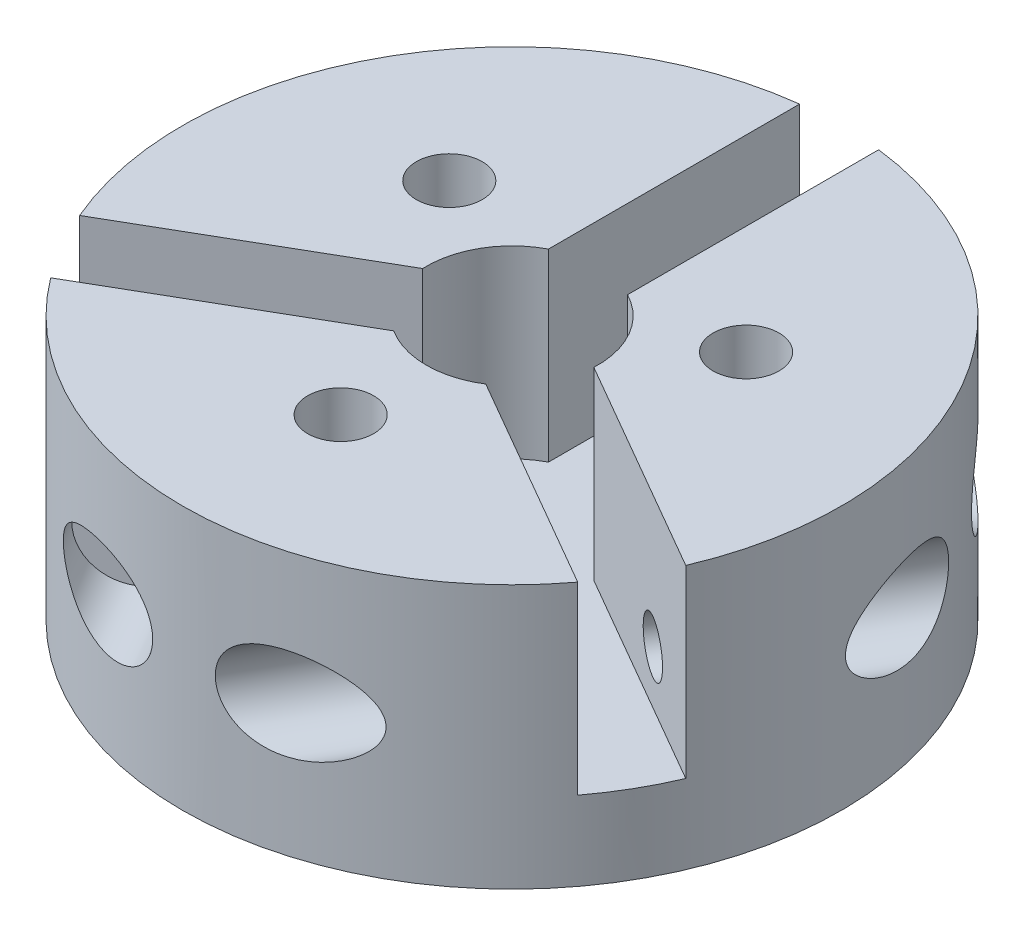
from build123d import *

# Parameters (mm, degrees)
SKETCH1_R                   = 125
BOSS_EXTRUDE1_DEPTH         = 50
SKETCH2_R                   = 12.5
CUT_EXTRUDE1_DEPTH          = 100
CUT_EXTRUDE2_DEPTH          = 70
SKETCH4_R                   = 10
CUT_EXTRUDE3_DEPTH          = 184.711730709
SKETCH6_R                   = 17.5
CUT_EXTRUDE5_DEPTH          = 55
CIRPATTERN2_COUNT           = 3
CIRPATTERN3_COPY_1_SKETCH_R = 17.5
CIRPATTERN3_COPY_1_DEPTH    = 55
CIRPATTERN3_COPY_2_SKETCH_R = 17.5
CIRPATTERN3_COPY_2_DEPTH    = 55
CIRPATTERN3_COPY_3_SKETCH_R = 17.5
CIRPATTERN3_COPY_3_DEPTH    = 55
CIRPATTERN3_COPY_4_SKETCH_R = 17.5
CIRPATTERN3_COPY_4_DEPTH    = 55
CIRPATTERN4_COUNT           = 3


with BuildPart() as part:
    # Sketch1 → Boss-Extrude1 (new, symmetric)
    with BuildSketch(Plane(origin=(0, 0, 0), x_dir=(1, 0, 0), z_dir=(0, 1, 0))):
        with Locations(Location((0, 0, 0), (0, 0, 270))):
            Circle(SKETCH1_R)
    extrude(amount=BOSS_EXTRUDE1_DEPTH, both=True)

    # Sketch2 → Cut-Extrude1 (cut)
    with BuildSketch(Plane(origin=(0, 50, 0), x_dir=(1, 0, 0), z_dir=(0, 1, 0))):
        with Locations(Location((0, -65, 0), (0, 0, 270))):
            Circle(SKETCH2_R)
        with Locations(Location((-56.291651246, 32.5, 0), (0, 0, 270))):
            Circle(SKETCH2_R)
        with Locations(Location((56.291651246, 32.5, 0), (0, 0, 270))):
            Circle(SKETCH2_R)
    extrude(amount=-CUT_EXTRUDE1_DEPTH, mode=Mode.SUBTRACT)

    # Sketch3 → Cut-Extrude2 (cut)
    with BuildSketch(Plane(origin=(0, 50, 0), x_dir=(1, 0, 0), z_dir=(0, 1, 0))):
        with BuildLine():
            Line((-15, 124.09673646), (-15, 28.831406487))
            ThreePointArc((-15, 28.831406487), (-28.145825623, 16.25), (-32.468730444, -1.425322187))
            Line((-32.468730444, -1.425322187), (-114.970926301, -49.057987173))
            ThreePointArc((-114.970926301, -49.057987173), (-108.253175473, -62.5), (-99.970926301, -75.038749287))
            Line((-99.970926301, -75.038749287), (-17.468730444, -27.4060843))
            ThreePointArc((-17.468730444, -27.4060843), (0, -32.5), (17.468730444, -27.4060843))
            Line((17.468730444, -27.4060843), (99.970926301, -75.038749287))
            ThreePointArc((99.970926301, -75.038749287), (108.253175473, -62.5), (114.970926301, -49.057987173))
            Line((114.970926301, -49.057987173), (32.468730444, -1.425322187))
            ThreePointArc((32.468730444, -1.425322187), (28.145825623, 16.25), (15, 28.831406487))
            Line((15, 28.831406487), (15, 124.09673646))
            ThreePointArc((15, 124.09673646), (0, 125), (-15, 124.09673646))
        make_face()
    extrude(amount=-CUT_EXTRUDE2_DEPTH, mode=Mode.SUBTRACT)

    # Sketch4 → Cut-Extrude3 (cut, symmetric)
    with BuildSketch(Plane(origin=(0, 0, 0), x_dir=(0, 0, -1), z_dir=(1, 0, 0))):
        with Locations((90, 0)):
            Circle(SKETCH4_R)
    cut_extrude3 = extrude(amount=CUT_EXTRUDE3_DEPTH, both=True, mode=Mode.SUBTRACT)

    # Sketch6 → Cut-Extrude5 (cut)
    with BuildSketch(Plane(origin=(55, 0, 0), x_dir=(0, 0, -1), z_dir=(1, 0, 0))):
        with Locations(Location((90, 0, 0), (0, 0, 180))):
            Circle(SKETCH6_R)
    cut_extrude5 = extrude(amount=CUT_EXTRUDE5_DEPTH, mode=Mode.SUBTRACT)

    # Mirror1: Cut-Extrude5 across plane
    add(cut_extrude5.mirror(Plane(origin=(0, 0, 0), x_dir=(0, 0, 1), z_dir=(1, 0, 0))), mode=Mode.SUBTRACT)

    # CirPattern2: Cut-Extrude5 ×3 about axis
    cirpattern2_axis = Axis((0, 0, 0), (0, 1, 0))
    for i in range(1, CIRPATTERN2_COUNT):
        add(cut_extrude5.rotate(cirpattern2_axis, i * 360 / CIRPATTERN2_COUNT), mode=Mode.SUBTRACT)

    # CirPattern3 copy 1 sketch → CirPattern3 copy 1 (cut)
    with BuildSketch(Plane(origin=(27.5, 0, 47.631397208), x_dir=(-0.8660254037844387, 0, 0.4999999999999998), z_dir=(0.4999999999999998, 0, 0.8660254037844387))):
        with Locations((90, 0)):
            Circle(CIRPATTERN3_COPY_1_SKETCH_R)
    extrude(amount=CIRPATTERN3_COPY_1_DEPTH, mode=Mode.SUBTRACT)

    # CirPattern3 copy 2 sketch → CirPattern3 copy 2 (cut)
    with BuildSketch(Plane(origin=(27.5, 0, -47.631397208), x_dir=(0.8660254037844384, 0, 0.5000000000000004), z_dir=(0.5000000000000004, 0, -0.8660254037844384))):
        with Locations((90, 0)):
            Circle(CIRPATTERN3_COPY_2_SKETCH_R)
    extrude(amount=CIRPATTERN3_COPY_2_DEPTH, mode=Mode.SUBTRACT)

    # CirPattern3 copy 3 sketch → CirPattern3 copy 3 (cut)
    with BuildSketch(Plane(origin=(-27.5, 0, -47.631397208), x_dir=(-0.8660254037844387, 0, 0.4999999999999998), z_dir=(-0.4999999999999998, 0, -0.8660254037844387))):
        with Locations(Location((90, 0, 0), (0, 0, 180))):
            Circle(CIRPATTERN3_COPY_3_SKETCH_R)
    extrude(amount=CIRPATTERN3_COPY_3_DEPTH, mode=Mode.SUBTRACT)

    # CirPattern3 copy 4 sketch → CirPattern3 copy 4 (cut)
    with BuildSketch(Plane(origin=(-27.5, 0, 47.631397208), x_dir=(0.8660254037844384, 0, 0.5000000000000004), z_dir=(-0.5000000000000004, 0, 0.8660254037844384))):
        with Locations(Location((90, 0, 0), (0, 0, 180))):
            Circle(CIRPATTERN3_COPY_4_SKETCH_R)
    extrude(amount=CIRPATTERN3_COPY_4_DEPTH, mode=Mode.SUBTRACT)

    # CirPattern4: Cut-Extrude3 ×3 about axis
    cirpattern4_axis = Axis((0, -20, 0), (0, 1, 0))
    for i in range(1, CIRPATTERN4_COUNT):
        add(cut_extrude3.rotate(cirpattern4_axis, i * 360 / CIRPATTERN4_COUNT), mode=Mode.SUBTRACT)


solid = part.part
